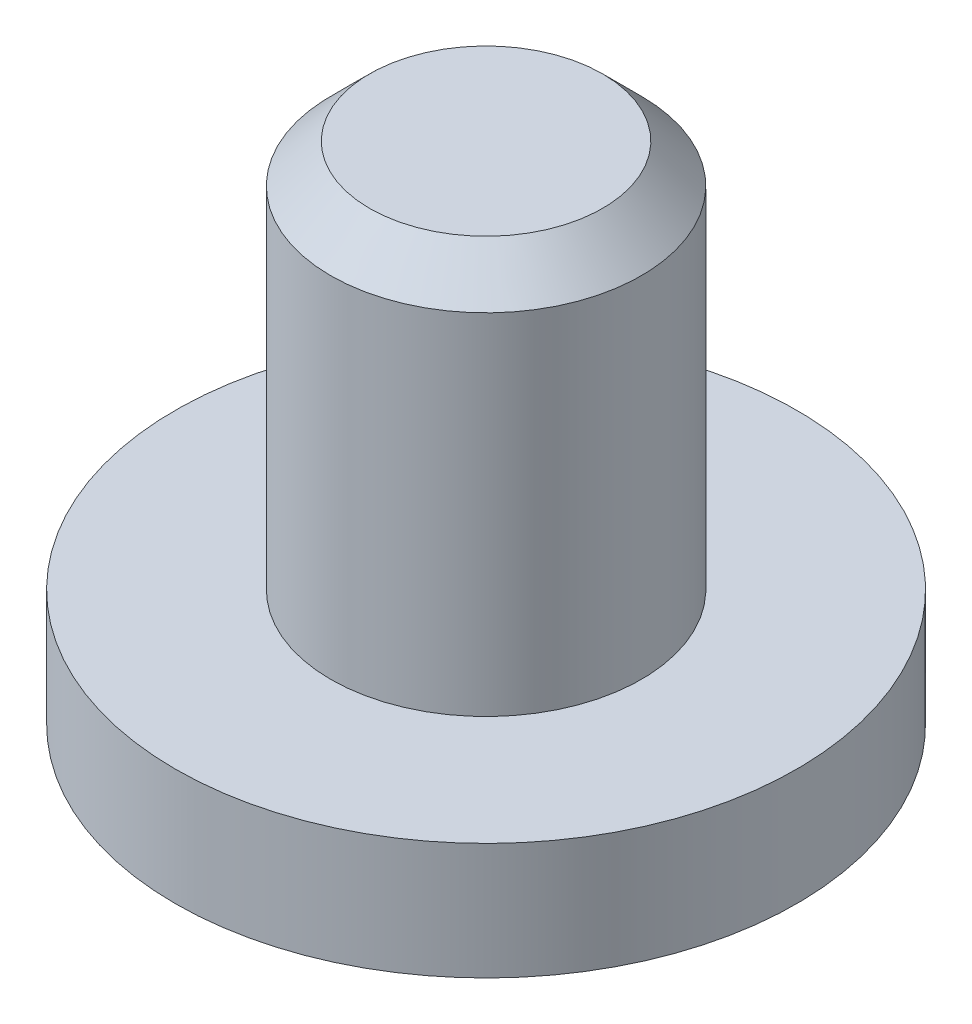
from build123d import *

# Parameters (mm, degrees)
CHAMFER_1_SIZE = 0.5


with BuildPart() as part:
    # 草图2 → 旋转1 (revolve)
    with BuildSketch(Plane.XY, mode=Mode.PRIVATE) as revolve_1_sk:
        Polygon((0, 0), (4, 0), (4, 1.5), (2, 1.5), (2, 6.5), (0, 6.5), align=None)
    revolve(revolve_1_sk.sketch.rotate(Axis((0, 6.5, 0), (0, -1, 0)), 90), axis=Axis((0, 6.5, 0), (0, -1, 0)))

    # 倒角1
    chamfer_1_edges = [part.edges().sort_by_distance(p)[0] for p in [
        (0, 6.5, -2),
    ]]
    chamfer(chamfer_1_edges, length=CHAMFER_1_SIZE)


solid = part.part
